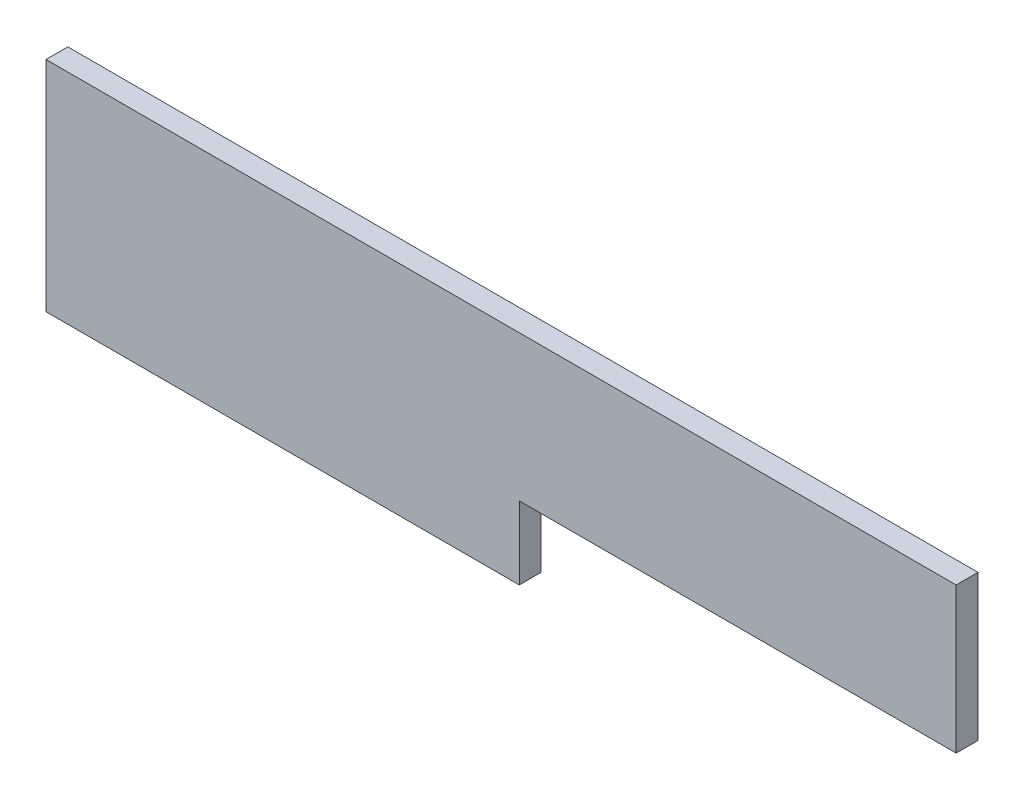
from build123d import *

# Parameters (mm, degrees)
EXTRUDE_1_DEPTH = 6


with BuildPart() as part:
    # Эскиз1 → Бобышка-Вытянуть1 (new body)
    with BuildSketch(Plane.XY):
        Polygon((-65, 0), (-65, 60), (185, 60), (185, 20), (65, 20), (65, 0), align=None)
    extrude(amount=-EXTRUDE_1_DEPTH)


solid = part.part
